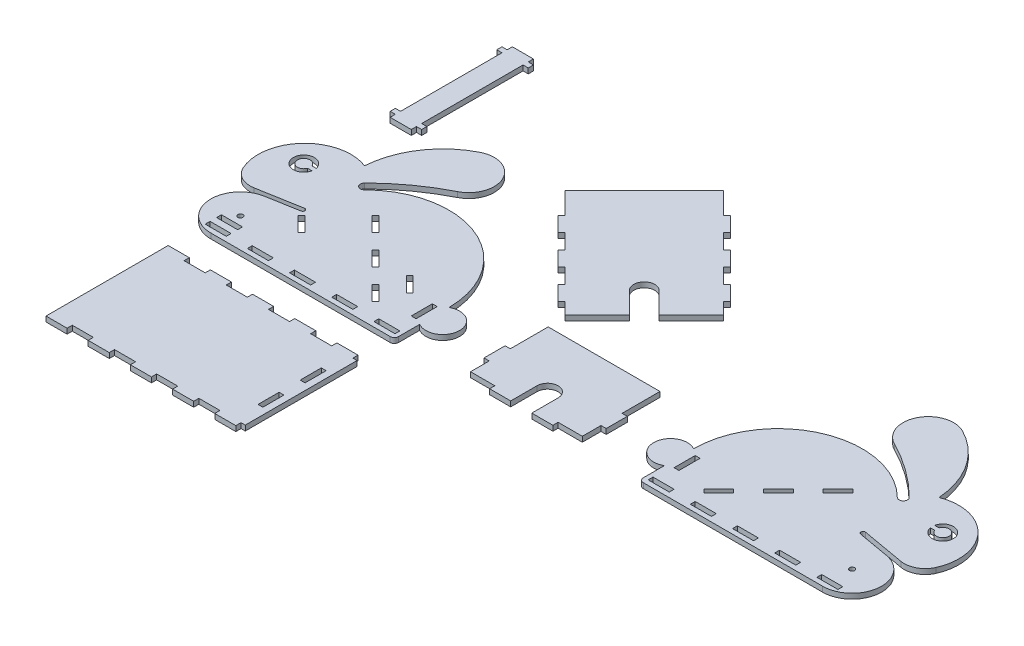
from build123d import *

# Parameters (mm, degrees)
SKETCH16_R            = 1.524
SKETCH16_W            = 12.7
SKETCH16_H            = 2.921
SKETCH16_W_2          = 2.921
SKETCH16_H_2          = 12.7
BOSS_EXTRUDE2_DEPTH   = 3.1242
BOSS_EXTRUDE2_2_DEPTH = 3.1242
BOSS_EXTRUDE2_3_DEPTH = 3.1242
BOSS_EXTRUDE2_4_DEPTH = 3.1242
BOSS_EXTRUDE2_5_DEPTH = 3.1242
BOSS_EXTRUDE2_6_DEPTH = 3.1242


with BuildPart() as part:
    # Sketch16 → Boss-Extrude2 (new body)
    with BuildSketch(Plane(origin=(0, 0, 0), x_dir=(1, 0, 0), z_dir=(0, 1, 0))):
        with BuildLine():
            Line((-61.349740805, -19.32673519), (-35.567943275, -14.780708674))
            ThreePointArc((-35.567943275, -14.780708674), (-34.096704243, -15.810881335), (-35.126876904, -17.282120367))
            Line((-35.126876904, -17.282120367), (-53.887464599, -20.590118151))
            ThreePointArc((-53.887464599, -20.590118151), (-68.512341732, -39.649629106), (-50.8, -55.88))
            Line((-50.8, -55.88), (57.15, -55.88))
            ThreePointArc((57.15, -55.88), (58.946051224, -55.136051224), (59.69, -53.34))
            Line((59.69, -53.34), (59.69, -40.64))
            ThreePointArc((59.69, -40.64), (74.93, -31.841181898), (59.69, -23.042363795))
            ThreePointArc((59.69, -23.042363795), (28.330318364, 23.890716456), (-27.031024484, 12.878660689))
            ThreePointArc((-27.031024484, 12.878660689), (-30.623126933, 12.878660689), (-30.623126933, 16.470763138))
            ThreePointArc((-30.623126933, 16.470763138), (-15.294458343, 29.540157862), (1.907841878, 40.021475828))
            ThreePointArc((1.907841878, 40.021475828), (8.637643659, 60.496459784), (-11.837340297, 67.226261564))
            ThreePointArc((-11.837340297, 67.226261564), (-31.23613579, 50.004716571), (-39.603383054, 25.451019259))
            ThreePointArc((-39.603383054, 25.451019259), (-69.886632847, 18.61484801), (-75.159732124, -11.97931613))
            ThreePointArc((-75.159732124, -11.97931613), (-69.520219899, -18.031590855), (-61.349740805, -19.32673519))
        make_face()
        with Locations(Location((-50.8, -38.1, 0), (0, 0, 270))):
            Circle(SKETCH16_R, mode=Mode.SUBTRACT)
        with Locations((25.4, -51.4985)):
            Rectangle(SKETCH16_W, SKETCH16_H, mode=Mode.SUBTRACT)
        with Locations((50.8, -51.4985)):
            Rectangle(SKETCH16_W, SKETCH16_H, mode=Mode.SUBTRACT)
        with Locations((54.229, -32.4485)):
            Rectangle(SKETCH16_W_2, SKETCH16_H_2, mode=Mode.SUBTRACT)
        with Locations((-50.8, -51.4985)):
            Rectangle(SKETCH16_W, SKETCH16_H, mode=Mode.SUBTRACT)
        with Locations((-25.4, -51.4985)):
            Rectangle(SKETCH16_W, SKETCH16_H, mode=Mode.SUBTRACT)
        with Locations((0, -51.4985)):
            Rectangle(SKETCH16_W, SKETCH16_H, mode=Mode.SUBTRACT)
        Polygon((6.520180976, -16.182434424), (15.500437098, -25.162690545), (17.565896005, -23.097231637), (8.585639884, -14.116975516), align=None, mode=Mode.SUBTRACT)
        Polygon((-9.374872358, 3.843536726), (-11.440331266, 1.778077819), (-2.460075145, -7.202178303), (-0.394616237, -5.136719395), align=None, mode=Mode.SUBTRACT)
        with BuildLine():
            Line((-55.426820149, 9.561240294), (-52.797218651, 9.561240294))
            ThreePointArc((-52.797218651, 9.561240294), (-65.368922598, 8.291240294), (-52.797218651, 7.021240294))
            Line((-52.797218651, 7.021240294), (-55.426820149, 7.021240294))
            ThreePointArc((-55.426820149, 7.021240294), (-62.828922598, 8.291240294), (-55.426820149, 9.561240294))
        make_face(mode=Mode.SUBTRACT)
        Polygon((33.46094934, -43.123202787), (35.526408248, -41.057743879), (26.546152126, -32.077487758), (24.480693219, -34.142946666), align=None, mode=Mode.SUBTRACT)
        with Locations((-50.8, -44.6405)):
            Rectangle(SKETCH16_W, SKETCH16_H, mode=Mode.SUBTRACT)
        Polygon((-33.711366446, -20.492957362), (-24.731110325, -29.473213483), (-22.665651417, -27.407754575), (-31.645907538, -18.427498454), align=None, mode=Mode.SUBTRACT)
        Polygon((30.317859697, -19.325524066), (39.298115818, -28.305780187), (41.363574726, -26.240321279), (32.383318605, -17.260065158), align=None, mode=Mode.SUBTRACT)
    extrude(amount=BOSS_EXTRUDE2_DEPTH)


with BuildPart() as body_2:
    # Sketch16 → Boss-Extrude2 2 (new body)
    with BuildSketch(Plane(origin=(0, 0, 0), x_dir=(1, 0, 0), z_dir=(0, 1, 0))):
        with BuildLine():
            Line((302.267943275, -14.780708674), (328.049740805, -19.32673519))
            ThreePointArc((328.049740805, -19.32673519), (336.220219899, -18.031590855), (341.859732124, -11.97931613))
            ThreePointArc((341.859732124, -11.97931613), (336.586632847, 18.61484801), (306.303383054, 25.451019259))
            ThreePointArc((306.303383054, 25.451019259), (297.93613579, 50.004716571), (278.537340297, 67.226261564))
            ThreePointArc((278.537340297, 67.226261564), (258.062356341, 60.496459784), (264.792158122, 40.021475828))
            ThreePointArc((264.792158122, 40.021475828), (281.994458343, 29.540157862), (297.323126933, 16.470763138))
            ThreePointArc((297.323126933, 16.470763138), (297.323126933, 12.878660689), (293.731024484, 12.878660689))
            ThreePointArc((293.731024484, 12.878660689), (238.369681636, 23.890716456), (207.01, -23.042363795))
            ThreePointArc((207.01, -23.042363795), (191.77, -31.841181898), (207.01, -40.64))
            Line((207.01, -40.64), (207.01, -53.34))
            ThreePointArc((207.01, -53.34), (207.753948776, -55.136051224), (209.55, -55.88))
            Line((209.55, -55.88), (317.5, -55.88))
            ThreePointArc((317.5, -55.88), (335.212341732, -39.649629106), (320.587464599, -20.590118151))
            Line((320.587464599, -20.590118151), (301.826876904, -17.282120367))
            ThreePointArc((301.826876904, -17.282120367), (300.796704243, -15.810881335), (302.267943275, -14.780708674))
        make_face()
        with Locations(Location((317.5, -38.1, 0), (0, 0, 270))):
            Circle(SKETCH16_R, mode=Mode.SUBTRACT)
        with BuildLine():
            Line((322.126820149, 7.021240294), (319.497218651, 7.021240294))
            ThreePointArc((319.497218651, 7.021240294), (332.068922598, 8.291240294), (319.497218651, 9.561240294))
            Line((319.497218651, 9.561240294), (322.126820149, 9.561240294))
            ThreePointArc((322.126820149, 9.561240294), (329.528922598, 8.291240294), (322.126820149, 7.021240294))
        make_face(mode=Mode.SUBTRACT)
        Polygon((231.173591752, -41.057743879), (233.23905066, -43.123202787), (242.219306781, -34.142946666), (240.153847874, -32.077487758), align=None, mode=Mode.SUBTRACT)
        with Locations((292.1, -51.4985)):
            Rectangle(SKETCH16_W, SKETCH16_H, mode=Mode.SUBTRACT)
        with Locations((317.5, -51.4985)):
            Rectangle(SKETCH16_W, SKETCH16_H, mode=Mode.SUBTRACT)
        Polygon((276.074872358, 3.843536726), (267.094616237, -5.136719395), (269.160075145, -7.202178303), (278.140331266, 1.778077819), align=None, mode=Mode.SUBTRACT)
        Polygon((249.134103995, -23.097231637), (251.199562902, -25.162690545), (260.179819024, -16.182434424), (258.114360116, -14.116975516), align=None, mode=Mode.SUBTRACT)
        with Locations((212.471, -32.4485)):
            Rectangle(SKETCH16_W_2, SKETCH16_H_2, mode=Mode.SUBTRACT)
        with Locations((215.9, -51.4985)):
            Rectangle(SKETCH16_W, SKETCH16_H, mode=Mode.SUBTRACT)
        with Locations((241.3, -51.4985)):
            Rectangle(SKETCH16_W, SKETCH16_H, mode=Mode.SUBTRACT)
        with Locations((266.7, -51.4985)):
            Rectangle(SKETCH16_W, SKETCH16_H, mode=Mode.SUBTRACT)
    extrude(amount=BOSS_EXTRUDE2_2_DEPTH)


with BuildPart() as body_3:
    # Sketch16 → Boss-Extrude2 3 (new body)
    with BuildSketch(Plane(origin=(0, 0, 0), x_dir=(1, 0, 0), z_dir=(0, 1, 0))):
        Polygon((-44.45, -148.7932), (-44.45, -145.669), (-31.75, -145.669), (-31.75, -148.7932), (-19.05, -148.7932), (-19.05, -145.669), (-6.35, -145.669), (-6.35, -148.7932), (6.35, -148.7932), (6.35, -145.669), (19.05, -145.669), (19.05, -148.7932), (31.75, -148.7932), (31.75, -145.669), (44.45, -145.669), (44.45, -148.7932), (57.15, -148.7932), (57.15, -145.669), (59.69, -145.669), (59.69, -78.359), (57.15, -78.359), (57.15, -75.2348), (44.45, -75.2348), (44.45, -78.359), (31.75, -78.359), (31.75, -75.2348), (19.05, -75.2348), (19.05, -78.359), (6.35, -78.359), (6.35, -75.2348), (-6.35, -75.2348), (-6.35, -78.359), (-19.05, -78.359), (-19.05, -75.2348), (-31.75, -75.2348), (-31.75, -78.359), (-44.45, -78.359), (-44.45, -75.2348), (-57.15, -75.2348), (-57.15, -78.359), (-57.15, -145.669), (-57.15, -148.7932), align=None)
        with Locations((54.229, -99.314)):
            Rectangle(SKETCH16_W_2, SKETCH16_H_2, mode=Mode.SUBTRACT)
        with Locations((54.229, -124.714)):
            Rectangle(SKETCH16_W_2, SKETCH16_H_2, mode=Mode.SUBTRACT)
    extrude(amount=BOSS_EXTRUDE2_3_DEPTH)


with BuildPart() as body_4:
    # Sketch16 → Boss-Extrude2 4 (new body)
    with BuildSketch(Plane(origin=(0, 0, 0), x_dir=(1, 0, 0), z_dir=(0, 1, 0))):
        with BuildLine():
            Line((127, -53.1622), (127, -50.038))
            Line((127, -50.038), (127, -37.338))
            ThreePointArc((127, -37.338), (133.35, -30.988), (139.7, -37.338))
            Line((139.7, -37.338), (139.7, -50.038))
            Line((139.7, -50.038), (139.7, -53.1622))
            Line((139.7, -53.1622), (152.4, -53.1622))
            Line((152.4, -53.1622), (152.4, -50.038))
            Line((152.4, -50.038), (167.005, -50.038))
            Line((167.005, -50.038), (167.005, -38.7985))
            Line((167.005, -38.7985), (170.1292, -38.7985))
            Line((170.1292, -38.7985), (170.1292, -26.0985))
            Line((170.1292, -26.0985), (167.005, -26.0985))
            Line((167.005, -26.0985), (167.005, -3.282637083))
            Line((167.005, -3.282637083), (99.695, -3.282637083))
            Line((99.695, -3.282637083), (99.695, -26.0985))
            Line((99.695, -26.0985), (96.5708, -26.0985))
            Line((96.5708, -26.0985), (96.5708, -38.7985))
            Line((96.5708, -38.7985), (99.695, -38.7985))
            Line((99.695, -38.7985), (99.695, -50.038))
            Line((99.695, -50.038), (114.3, -50.038))
            Line((114.3, -50.038), (114.3, -53.1622))
            Line((114.3, -53.1622), (127, -53.1622))
        make_face()
    extrude(amount=BOSS_EXTRUDE2_4_DEPTH)


with BuildPart() as body_5:
    # Sketch16 → Boss-Extrude2 5 (new body)
    with BuildSketch(Plane(origin=(0, 0, 0), x_dir=(1, 0, 0), z_dir=(0, 1, 0))):
        with BuildLine():
            Line((126.819691974, 36.405945421), (146.127242635, 55.713496082))
            Line((146.127242635, 55.713496082), (139.212445421, 62.628293295))
            Line((139.212445421, 62.628293295), (141.421588427, 64.837436301))
            Line((141.421588427, 64.837436301), (132.441332306, 73.817692422))
            Line((132.441332306, 73.817692422), (130.2321893, 71.608549416))
            Line((130.2321893, 71.608549416), (121.251933179, 80.588805537))
            Line((121.251933179, 80.588805537), (123.461076185, 82.797948543))
            Line((123.461076185, 82.797948543), (114.480820064, 91.778204664))
            Line((114.480820064, 91.778204664), (112.271677058, 89.569061658))
            Line((112.271677058, 89.569061658), (103.291420937, 98.549317779))
            Line((103.291420937, 98.549317779), (105.500563943, 100.758460785))
            Line((105.500563943, 100.758460785), (96.520307822, 109.738716906))
            Line((96.520307822, 109.738716906), (94.311164816, 107.5295739))
            Line((94.311164816, 107.5295739), (81.225094915, 120.615643801))
            Line((81.225094915, 120.615643801), (33.629737473, 73.02028636))
            Line((33.629737473, 73.02028636), (46.715807374, 59.934216459))
            Line((46.715807374, 59.934216459), (44.506664369, 57.725073453))
            Line((44.506664369, 57.725073453), (53.48692049, 48.744817332))
            Line((53.48692049, 48.744817332), (55.696063495, 50.953960338))
            Line((55.696063495, 50.953960338), (64.676319617, 41.973704216))
            Line((64.676319617, 41.973704216), (62.467176611, 39.764561211))
            Line((62.467176611, 39.764561211), (71.447432732, 30.78430509))
            Line((71.447432732, 30.78430509), (73.656575738, 32.993448095))
            Line((73.656575738, 32.993448095), (82.636831859, 24.013191974))
            Line((82.636831859, 24.013191974), (80.427688853, 21.804048969))
            Line((80.427688853, 21.804048969), (89.407944974, 12.823792847))
            Line((89.407944974, 12.823792847), (91.61708798, 15.032935853))
            Line((91.61708798, 15.032935853), (98.531885193, 8.11813864))
            Line((98.531885193, 8.11813864), (117.839435853, 27.4256893))
            Line((117.839435853, 27.4256893), (105.139435853, 40.1256893))
            ThreePointArc((105.139435853, 40.1256893), (105.139435853, 49.105945421), (114.119691974, 49.105945421))
            Line((114.119691974, 49.105945421), (126.819691974, 36.405945421))
        make_face()
    extrude(amount=BOSS_EXTRUDE2_5_DEPTH)


with BuildPart() as body_6:
    # Sketch16 → Boss-Extrude2 6 (new body)
    with BuildSketch(Plane(origin=(0, 0, 0), x_dir=(1, 0, 0), z_dir=(0, 1, 0))):
        Polygon((-60.2742, 125.73), (-57.15, 125.73), (-57.15, 64.6684), (-60.2742, 64.6684), (-60.2742, 61.5442), (-57.15, 61.5442), (-57.15, 58.42), (-44.45, 58.42), (-44.45, 61.5442), (-41.3258, 61.5442), (-41.3258, 64.6684), (-44.45, 64.6684), (-44.45, 125.73), (-41.3258, 125.73), (-41.3258, 128.8542), (-44.45, 128.8542), (-44.45, 131.9784), (-57.15, 131.9784), (-57.15, 128.8542), (-60.2742, 128.8542), align=None)
    extrude(amount=BOSS_EXTRUDE2_6_DEPTH)


solid = Compound([part.part, body_2.part, body_3.part, body_4.part, body_5.part, body_6.part])
